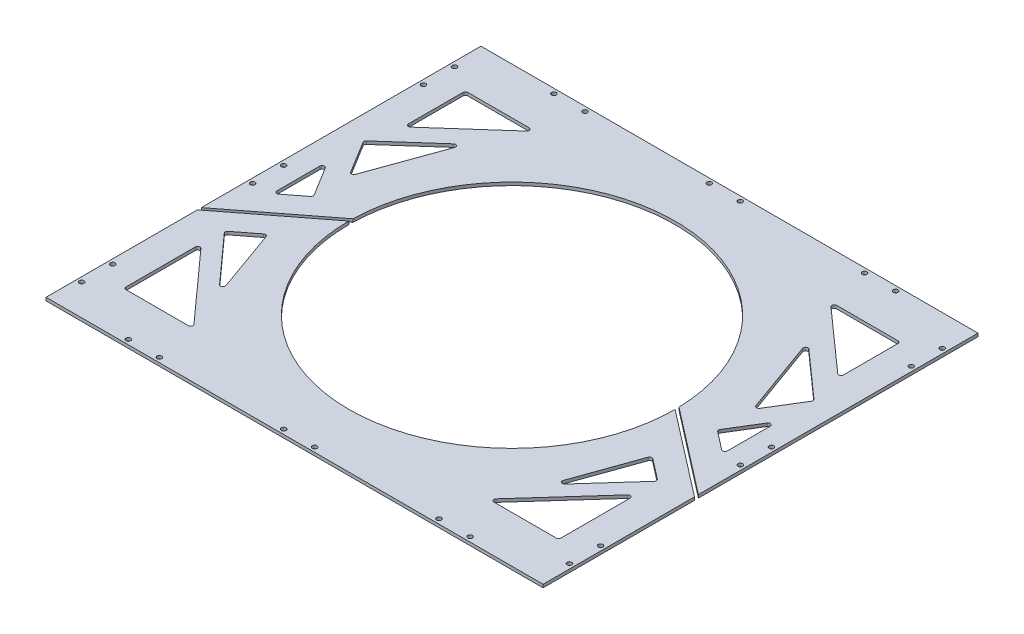
from build123d import *

# Parameters (mm, degrees)
SKETCH_1_W          = 320
SKETCH_1_H          = 280
SKETCH_1_R          = 105
EXTRUDE_1_DEPTH     = 2
CUT_EXTRUDE_1_DEPTH = 426.210536088
SKETCH_3_R          = 1.5
CUT_EXTRUDE_2_DEPTH = 426.210536088
CUT_EXTRUDE_3_DEPTH = 426.210536088


with BuildPart() as part:
    # 草图1 → 凸台-拉伸1 (new body)
    with BuildSketch(Plane(origin=(0, 0, 0), x_dir=(1, 0, 0), z_dir=(0, 1, 0))):
        with Locations((160, 140)):
            Rectangle(SKETCH_1_W, SKETCH_1_H)
        with Locations(Location((160, 140, 0), (0, 0, 270))):
            Circle(SKETCH_1_R, mode=Mode.SUBTRACT)
    extrude(amount=EXTRUDE_1_DEPTH)

    # 草图2 → 切除-拉伸1 (cut, through all)
    with BuildSketch(Plane(origin=(0, 2, 0), x_dir=(1, 0, 0), z_dir=(0, 1, 0))):
        with BuildLine():
            Line((55, 140), (0, 97.471839412))
            Line((0, 97.471839412), (0, 100))
            Line((0, 100), (55.031021038, 142.552147273))
            ThreePointArc((55.031021038, 142.552147273), (55.007755546, 141.276167897), (55, 140))
        make_face()
        with BuildLine():
            Line((320, 100), (264.968978962, 142.552147273))
            ThreePointArc((264.968978962, 142.552147273), (264.992244454, 141.276167897), (265, 140))
            Line((265, 140), (320, 97.471839412))
            Line((320, 97.471839412), (320, 100))
        make_face()
    extrude(amount=-CUT_EXTRUDE_1_DEPTH, mode=Mode.SUBTRACT)


with BuildPart() as cut_extrude_1_piece_1:
    # of the separate pieces the step leaves, piece 1, a body of its own (cut_extrude_1_pieces)
    add(part.part.solids().sort_by_distance((0, 0, -280))[0])


with BuildPart() as cut_extrude_1_piece_2:
    # of the separate pieces the step leaves, piece 2, a body of its own (cut_extrude_1_pieces)
    add(part.part.solids().sort_by_distance((0, 0, 0))[0])


with BuildPart() as cut_extrude_2_tool:
    # 草图3 → 切除-拉伸2 (new, through all)
    with BuildSketch(Plane(origin=(0, 2, 0), x_dir=(1, 0, 0), z_dir=(0, 1, 0))):
        with Locations(Location((3, 40, 0), (0, 0, 270))):
            Circle(SKETCH_3_R)
        with Locations(Location((3, 20, 0), (0, 0, 270))):
            Circle(SKETCH_3_R)
        with Locations(Location((50, 3, 0), (0, 0, 270))):
            Circle(SKETCH_3_R)
        with Locations(Location((70, 3, 0), (0, 0, 270))):
            Circle(SKETCH_3_R)
        with Locations(Location((70, 277, 0), (0, 0, 90))):
            Circle(SKETCH_3_R)
        with Locations(Location((50, 277, 0), (0, 0, 90))):
            Circle(SKETCH_3_R)
        with Locations(Location((3, 260, 0), (0, 0, 90))):
            Circle(SKETCH_3_R)
        with Locations(Location((3, 240, 0), (0, 0, 90))):
            Circle(SKETCH_3_R)
        with Locations(Location((317, 240, 0), (0, 0, 270))):
            Circle(SKETCH_3_R)
        with Locations(Location((317, 260, 0), (0, 0, 270))):
            Circle(SKETCH_3_R)
        with Locations(Location((270, 277, 0), (0, 0, 270))):
            Circle(SKETCH_3_R)
        with Locations(Location((250, 277, 0), (0, 0, 270))):
            Circle(SKETCH_3_R)
        with Locations(Location((250, 3, 0), (0, 0, 90))):
            Circle(SKETCH_3_R)
        with Locations(Location((270, 3, 0), (0, 0, 90))):
            Circle(SKETCH_3_R)
        with Locations(Location((317, 20, 0), (0, 0, 90))):
            Circle(SKETCH_3_R)
        with Locations(Location((317, 40, 0), (0, 0, 90))):
            Circle(SKETCH_3_R)
        with Locations(Location((3, 150, 0), (0, 0, 270))):
            Circle(SKETCH_3_R)
        with Locations(Location((3, 130, 0), (0, 0, 270))):
            Circle(SKETCH_3_R)
        with Locations(Location((317, 130, 0), (0, 0, 90))):
            Circle(SKETCH_3_R)
        with Locations(Location((317, 150, 0), (0, 0, 90))):
            Circle(SKETCH_3_R)
        with Locations(Location((150, 3, 0), (0, 0, 270))):
            Circle(SKETCH_3_R)
        with Locations(Location((170, 3, 0), (0, 0, 270))):
            Circle(SKETCH_3_R)
        with Locations(Location((170, 277, 0), (0, 0, 90))):
            Circle(SKETCH_3_R)
        with Locations(Location((150, 277, 0), (0, 0, 90))):
            Circle(SKETCH_3_R)
    extrude(amount=-CUT_EXTRUDE_2_DEPTH)


with BuildPart() as cut_extrude_1_piece_1_1:
    add(cut_extrude_1_piece_1.part)

    # 切除-拉伸2: cut by cut_extrude_2_tool
    add(cut_extrude_2_tool.part, mode=Mode.SUBTRACT)


with BuildPart() as cut_extrude_1_piece_2_1:
    add(cut_extrude_1_piece_2.part)

    # 切除-拉伸2: cut by cut_extrude_2_tool
    add(cut_extrude_2_tool.part, mode=Mode.SUBTRACT)


with BuildPart() as cut_extrude_3_tool:
    # 草图4 → 切除-拉伸3 (new, through all)
    with BuildSketch(Plane(origin=(0, 2, 0), x_dir=(1, 0, 0), z_dir=(0, 1, 0))):
        with BuildLine():
            Line((20, 248.5), (20, 213.340265763))
            ThreePointArc((20, 213.340265763), (20.885515923, 211.971905679), (22.496545758, 212.219151785))
            Line((22.496545758, 212.219151785), (62.051246775, 247.378886022))
            ThreePointArc((62.051246775, 247.378886022), (62.456783569, 249.033070836), (61.054701016, 250))
            Line((61.054701016, 250), (21.5, 250))
            ThreePointArc((21.5, 250), (20.439339828, 249.560660172), (20, 248.5))
        make_face()
        with BuildLine():
            Line((45.595026632, 216.695675346), (15.939563384, 190.33526357))
            ThreePointArc((15.939563384, 190.33526357), (15.452205827, 189.433309239), (15.658021719, 188.428979203))
            Line((15.658021719, 188.428979203), (28.367505968, 167.740690122))
            ThreePointArc((28.367505968, 167.740690122), (29.799206253, 167.03374688), (31.056843746, 168.017557021))
            Line((31.056843746, 168.017557021), (48.002822745, 215.066257878))
            ThreePointArc((48.002822745, 215.066257878), (47.432253839, 216.816839398), (45.595026632, 216.695675346))
        make_face()
        with BuildLine():
            Line((15, 161.267840467), (15, 133.615773026))
            ThreePointArc((15, 133.615773026), (15.839064086, 132.269235348), (17.417551623, 132.429139544))
            Line((17.417551623, 132.429139544), (28.934338276, 141.334371403))
            ThreePointArc((28.934338276, 141.334371403), (29.492323955, 142.251209278), (29.294874076, 143.306175273))
            Line((29.294874076, 143.306175273), (17.778087423, 162.053010856))
            ThreePointArc((17.778087423, 162.053010856), (16.092036236, 162.711296586), (15, 161.267840467))
        make_face()
        with BuildLine():
            Line((20, 76.091062659), (20, 31.5))
            ThreePointArc((20, 31.5), (20.439339828, 30.439339828), (21.5, 30))
            Line((21.5, 30), (61.631956393, 30))
            ThreePointArc((61.631956393, 30), (63.002206488, 30.889742123), (62.746897612, 32.503447097))
            Line((62.746897612, 32.503447097), (22.614941219, 77.094509756))
            ThreePointArc((22.614941219, 77.094509756), (20.962604349, 77.491493276), (20, 76.091062659))
        make_face()
        with BuildLine():
            Line((34.702648454, 105.344086027), (21.79502329, 95.363403194))
            ThreePointArc((21.79502329, 95.363403194), (21.218630461, 94.311417312), (21.597633693, 93.173322615))
            Line((21.597633693, 93.173322615), (48.885164358, 62.853844099))
            ThreePointArc((48.885164358, 62.853844099), (50.768446808, 62.569016476), (51.412862838, 64.361391309))
            Line((51.412862838, 64.361391309), (37.032957337, 104.661552658))
            ThreePointArc((37.032957337, 104.661552658), (36.041828, 105.596976736), (34.702648454, 105.344086027))
        make_face()
        with BuildLine():
            Line((268.587137162, 64.361391309), (282.967042663, 104.661552658))
            ThreePointArc((282.967042663, 104.661552658), (283.958172, 105.596976736), (285.297351546, 105.344086027))
            Line((285.297351546, 105.344086027), (298.20497671, 95.363403194))
            ThreePointArc((298.20497671, 95.363403194), (298.781369539, 94.311417312), (298.402366307, 93.173322615))
            Line((298.402366307, 93.173322615), (271.114835642, 62.853844099))
            ThreePointArc((271.114835642, 62.853844099), (269.231553192, 62.569016476), (268.587137162, 64.361391309))
        make_face()
        with BuildLine():
            Line((257.253102388, 32.503447097), (297.385058781, 77.094509756))
            ThreePointArc((297.385058781, 77.094509756), (299.037395651, 77.491493276), (300, 76.091062659))
            Line((300, 76.091062659), (300, 31.5))
            ThreePointArc((300, 31.5), (299.560660172, 30.439339828), (298.5, 30))
            Line((298.5, 30), (258.368043607, 30))
            ThreePointArc((258.368043607, 30), (256.997793512, 30.889742123), (257.253102388, 32.503447097))
        make_face()
        with BuildLine():
            Line((290.705125924, 143.306175273), (302.221912577, 162.053010856))
            ThreePointArc((302.221912577, 162.053010856), (303.907963764, 162.711296586), (305, 161.267840467))
            Line((305, 161.267840467), (305, 133.615773026))
            ThreePointArc((305, 133.615773026), (304.160935914, 132.269235348), (302.582448377, 132.429139544))
            Line((302.582448377, 132.429139544), (291.065661724, 141.334371403))
            ThreePointArc((291.065661724, 141.334371403), (290.507676045, 142.251209278), (290.705125924, 143.306175273))
        make_face()
        with BuildLine():
            Line((288.943156254, 168.017557021), (271.997177255, 215.066257878))
            ThreePointArc((271.997177255, 215.066257878), (272.567746161, 216.816839398), (274.404973368, 216.695675346))
            Line((274.404973368, 216.695675346), (304.060436616, 190.33526357))
            ThreePointArc((304.060436616, 190.33526357), (304.547794173, 189.433309239), (304.341978281, 188.428979203))
            Line((304.341978281, 188.428979203), (291.632494032, 167.740690122))
            ThreePointArc((291.632494032, 167.740690122), (290.200793747, 167.03374688), (288.943156254, 168.017557021))
        make_face()
        with BuildLine():
            Line((258.945298984, 250), (298.5, 250))
            ThreePointArc((298.5, 250), (299.560660172, 249.560660172), (300, 248.5))
            Line((300, 248.5), (300, 213.340265763))
            ThreePointArc((300, 213.340265763), (299.114484077, 211.971905679), (297.503454242, 212.219151785))
            Line((297.503454242, 212.219151785), (257.948753225, 247.378886022))
            ThreePointArc((257.948753225, 247.378886022), (257.543216431, 249.033070836), (258.945298984, 250))
        make_face()
    extrude(amount=-CUT_EXTRUDE_3_DEPTH)


with BuildPart() as cut_extrude_1_piece_1_2:
    add(cut_extrude_1_piece_1_1.part)

    # 切除-拉伸3: cut by cut_extrude_3_tool
    add(cut_extrude_3_tool.part, mode=Mode.SUBTRACT)


with BuildPart() as cut_extrude_1_piece_2_2:
    add(cut_extrude_1_piece_2_1.part)

    # 切除-拉伸3: cut by cut_extrude_3_tool
    add(cut_extrude_3_tool.part, mode=Mode.SUBTRACT)


solid = Compound([cut_extrude_1_piece_1_2.part, cut_extrude_1_piece_2_2.part])
